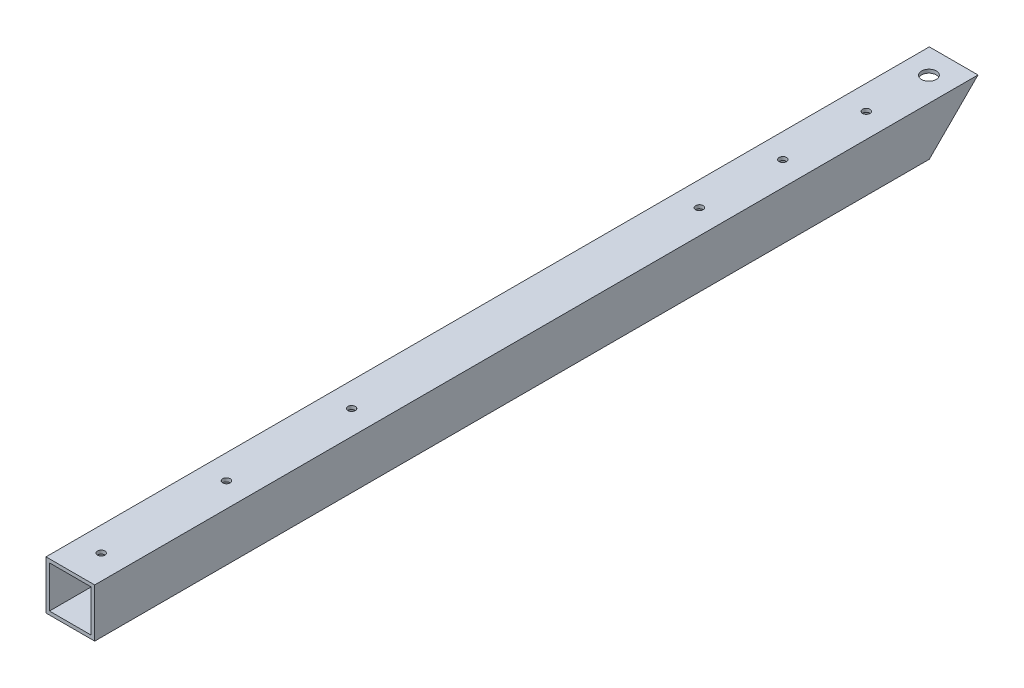
from build123d import *

# Parameters (mm, degrees)
SKETCH1_W               = 44.45
SKETCH1_H               = 44.45
SKETCH1_W_2             = 38.1
SKETCH1_H_2             = 38.1
BOSS_EXTRUDE1_DEPTH     = 1044.575
F_1_4_CLEARANCE_HOLE3_D = 6.7564
F_1_2_CLEARANCE_HOLE1_D = 13.49248
CUT_EXTRUDE1_DEPTH      = 1046.75651265
SKETCH18_W              = 44.45
SKETCH18_H              = 44.45
SKETCH18_W_2            = 38.1
SKETCH18_H_2            = 38.1
BOSS_EXTRUDE2_DEPTH     = 0.23876


with BuildPart() as part:
    # Sketch1 → Boss-Extrude1 (new body)
    with BuildSketch(Plane.XY):
        Rectangle(SKETCH1_W, SKETCH1_H)
        Rectangle(SKETCH1_W_2, SKETCH1_H_2, mode=Mode.SUBTRACT)
    extrude(amount=BOSS_EXTRUDE1_DEPTH)

    # 1/4 Clearance Hole3 (through all)
    with Locations(Plane(origin=(0, 22.225, 0), x_dir=(1, 0, 0), z_dir=(0, 1, 0))):
        with Locations((0, -318.135), (0, -394.335), (0, -470.535), (0, -788.035), (0, -902.335), (0, -1016.635)):
            Hole(F_1_4_CLEARANCE_HOLE3_D / 2)

    # 1/2 Clearance Hole1 (through all)
    with Locations(Plane(origin=(0, 22.225, 0), x_dir=(1, 0, 0), z_dir=(0, 1, 0))):
        with Locations((0, -260.985)):
            Hole(F_1_2_CLEARANCE_HOLE1_D / 2)

    # Sketch17 → Cut-Extrude1 (cut, through all)
    with BuildSketch(Plane.ZY.offset(22.225)):
        Polygon((282.81376, -22.225), (238.36376, 22.225), (0, 22.225), (0, -22.225), align=None)
    extrude(amount=-CUT_EXTRUDE1_DEPTH, mode=Mode.SUBTRACT)

    # Sketch18 → Boss-Extrude2 (add)
    with BuildSketch(Plane.XY.offset(1044.575)):
        Rectangle(SKETCH18_W, SKETCH18_H)
        Rectangle(SKETCH18_W_2, SKETCH18_H_2, mode=Mode.SUBTRACT)
    extrude(amount=BOSS_EXTRUDE2_DEPTH)


solid = part.part
